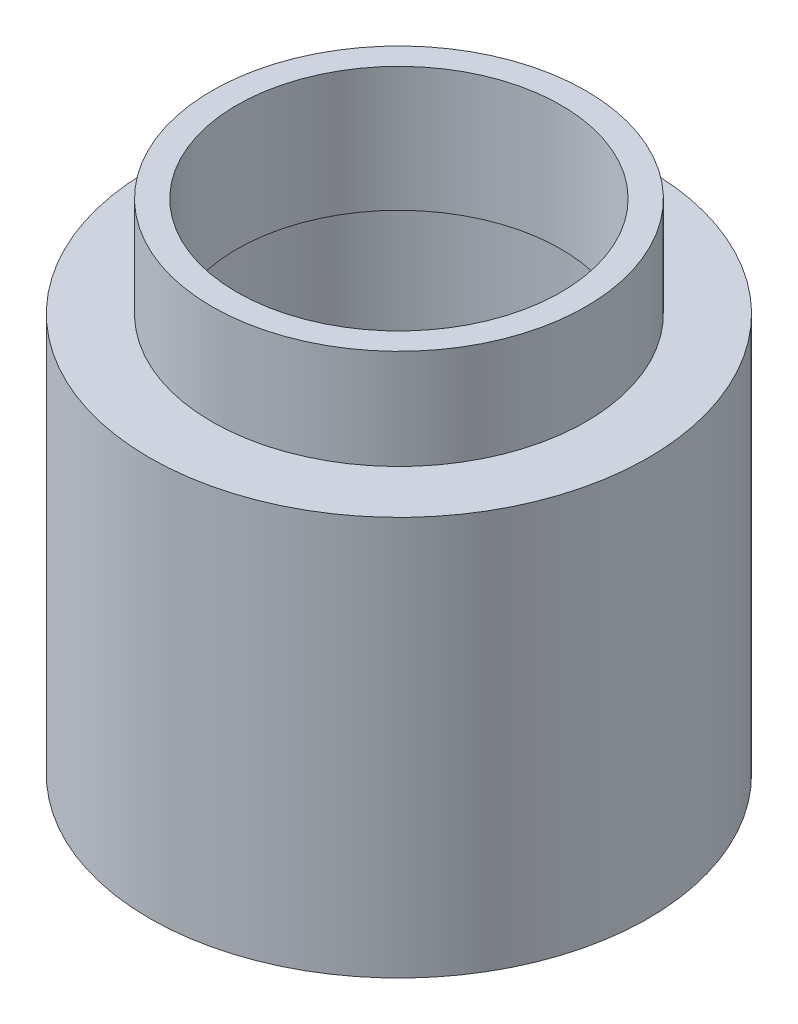
from build123d import *

# Parameters (mm, degrees)
SKETCH2_R           = 19.05
BOSS_EXTRUDE1_DEPTH = 12.7
SKETCH2_5_R         = 25.4
SKETCH2_5_R_2       = 19.05
BOSS_EXTRUDE3_DEPTH = 38.1
SHELL2_T            = -2.54
SKETCH32_R          = 9.525
CUT_EXTRUDE1_DEPTH  = 50.8
SKETCH2_10_R        = 25.4
SKETCH2_10_R_2      = 19.05
BOSS_EXTRUDE4_DEPTH = 2.54


with BuildPart() as part:
    # Sketch2 → Boss-Extrude1 (new body)
    with BuildSketch(Plane(origin=(0, 0, 0), x_dir=(1, 0, 0), z_dir=(0, 1, 0))):
        Circle(SKETCH2_R)
    extrude(amount=BOSS_EXTRUDE1_DEPTH)

    # Shell2
    shell2_openings = [part.faces().sort_by_distance(p)[0] for p in [
        (0, 0, 0),
        (0, 12.7, 0),
    ]]
    offset(amount=SHELL2_T, openings=shell2_openings, kind=Kind.INTERSECTION)



with BuildPart() as body_2:
    # Sketch2<5> → Boss-Extrude3 (new body)
    with BuildSketch(Plane(origin=(0, 0, 0), x_dir=(1, 0, 0), z_dir=(0, 1, 0))):
        Circle(SKETCH2_5_R)
        Circle(SKETCH2_5_R_2, mode=Mode.SUBTRACT)
    extrude(amount=-BOSS_EXTRUDE3_DEPTH)

    # Sketch32 → Cut-Extrude1 (cut)
    with BuildSketch(Plane(origin=(0, 0, 0), x_dir=(0, 0, -1), z_dir=(1, 0, 0))):
        with Locations((0, -19.05)):
            Circle(SKETCH32_R)
    extrude(amount=-CUT_EXTRUDE1_DEPTH, mode=Mode.SUBTRACT)


with BuildPart() as part_1:
    add(part.part)

    add(body_2.part)  # Boss-Extrude4 merges body 2
    # Sketch2<10> → Boss-Extrude4 (add)
    with BuildSketch(Plane(origin=(0, 0, 0), x_dir=(1, 0, 0), z_dir=(0, 1, 0))):
        Circle(SKETCH2_10_R)
        Circle(SKETCH2_10_R_2, mode=Mode.SUBTRACT)
    extrude(amount=BOSS_EXTRUDE4_DEPTH)


solid = part_1.part
